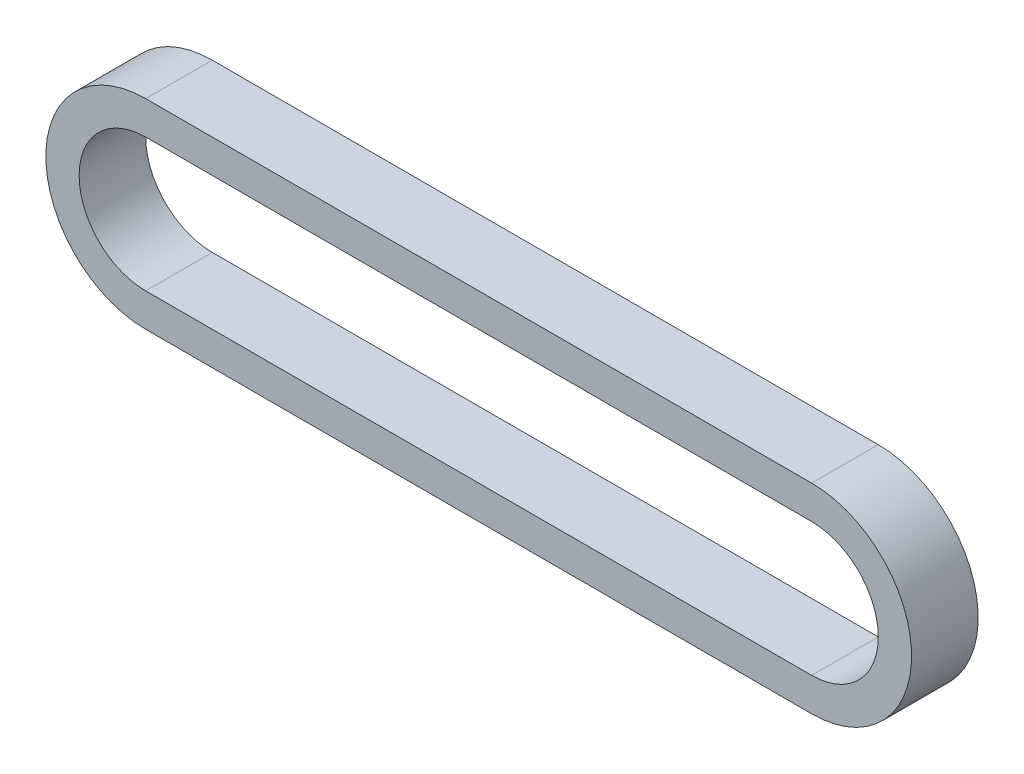
from build123d import *

# Parameters (mm, degrees)
EXTRUDE_1_DEPTH = 0.5


with BuildPart() as part:
    # 草图1 → 凸台-拉伸1 (new, symmetric)
    with BuildSketch(Plane.XY):
        with BuildLine():
            Line((-5.027393095, 5.351295181), (4.972606905, 5.351295181))
            ThreePointArc((4.972606905, 5.351295181), (6.472606905, 3.851295181), (4.972606905, 2.351295181))
            Line((4.972606905, 2.351295181), (-5.027393095, 2.351295181))
            ThreePointArc((-5.027393095, 2.351295181), (-6.527393095, 3.851295181), (-5.027393095, 5.351295181))
        make_face()
        with BuildLine():
            Line((-5.027393095, 4.851295181), (4.972606905, 4.851295181))
            ThreePointArc((4.972606905, 4.851295181), (5.972606905, 3.851295181), (4.972606905, 2.851295181))
            Line((4.972606905, 2.851295181), (-5.027393095, 2.851295181))
            ThreePointArc((-5.027393095, 2.851295181), (-6.027393095, 3.851295181), (-5.027393095, 4.851295181))
        make_face(mode=Mode.SUBTRACT)
    extrude(amount=EXTRUDE_1_DEPTH, both=True)


solid = part.part
